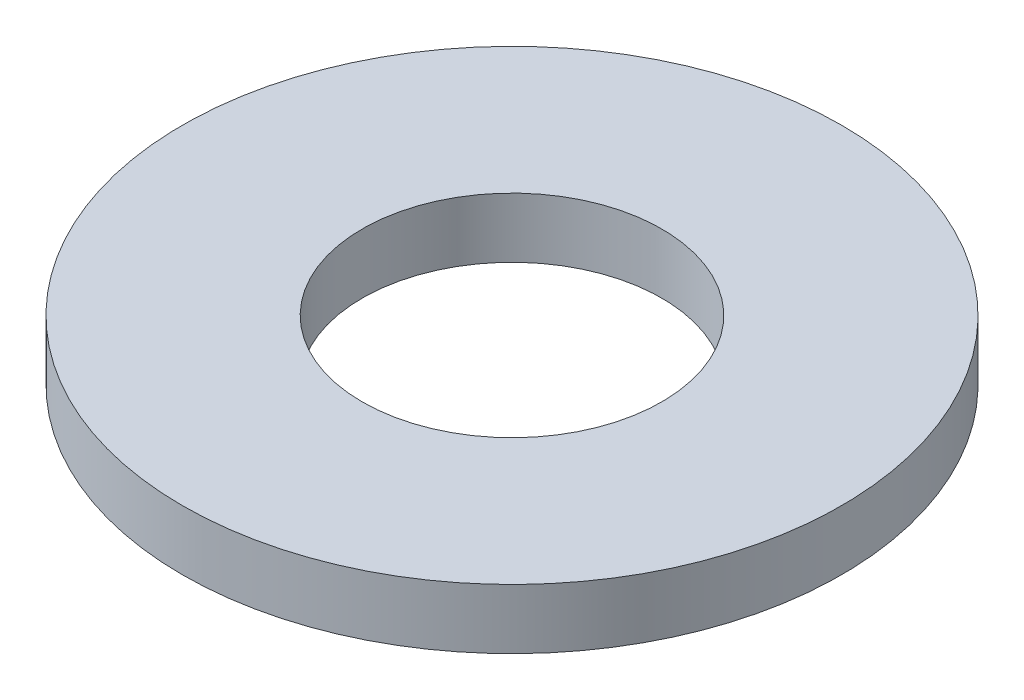
from build123d import *

# Parameters (mm, degrees)
SKETCH1_R           = 2.75
SKETCH1_R_2         = 1.25
BOSS_EXTRUDE1_DEPTH = 0.5


with BuildPart() as part:
    # Sketch1 → Boss-Extrude1 (new body)
    with BuildSketch(Plane(origin=(0, 0, 0), x_dir=(1, 0, 0), z_dir=(0, 1, 0))):
        with Locations(Location((0, 0, 0), (0, 0, 270))):
            Circle(SKETCH1_R)
        with Locations(Location((0, 0, 0), (0, 0, 270))):
            Circle(SKETCH1_R_2, mode=Mode.SUBTRACT)
    extrude(amount=BOSS_EXTRUDE1_DEPTH)


solid = part.part
